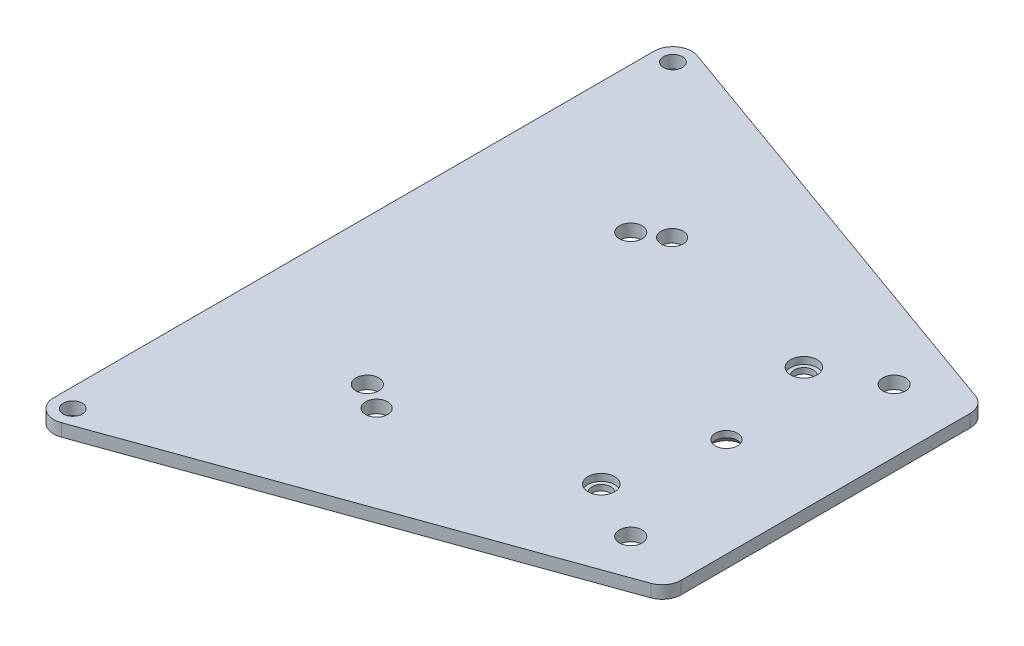
from build123d import *

# Parameters (mm, degrees)
CROQUIS1_R              = 1.8
CROQUIS1_R_2            = 1.5
CROQUIS1_R_3            = 1.75
SALIENTE_EXTRUIR1_DEPTH = 2
CROQUIS2_R              = 2.6
CORTAR_EXTRUIR1_DEPTH   = 1
CORTAR_EXTRUIR1_DRAFT   = -40
CROQUIS3_R              = 2.1
CORTAR_EXTRUIR2_DEPTH   = 1.1


with BuildPart() as part:
    # Croquis1 → Saliente-Extruir1 (new body)
    with BuildSketch(Plane(origin=(0, 0, 0), x_dir=(1, 0, 0), z_dir=(0, 1, 0))):
        with BuildLine():
            Line((1.012419451, 2.824005463), (69.732419451, -21.812442877))
            ThreePointArc((69.732419451, -21.812442877), (71.173289461, -22.909783687), (71.72, -24.63644834))
            Line((71.72, -24.63644834), (71.72, -70.41355166))
            ThreePointArc((71.72, -70.41355166), (71.173289461, -72.140216313), (69.732419451, -73.237557123))
            Line((69.732419451, -73.237557123), (1.012419451, -97.874005463))
            ThreePointArc((1.012419451, -97.874005463), (-1.726664653, -97.503289461), (-3, -95.05))
            Line((-3, -95.05), (-3, 0))
            ThreePointArc((-3, 0), (-1.726664653, 2.453289461), (1.012419451, 2.824005463))
        make_face()
        with Locations(Location((20, -26.675, 0), (0, 0, 270))):
            Circle(CROQUIS1_R, mode=Mode.SUBTRACT)
        with Locations(Location((20, -68.395, 0), (0, 0, 270))):
            Circle(CROQUIS1_R, mode=Mode.SUBTRACT)
        with Locations(Location((61.72, -26.675, 0), (0, 0, 270))):
            Circle(CROQUIS1_R, mode=Mode.SUBTRACT)
        with Locations(Location((61.72, -68.395, 0), (0, 0, 270))):
            Circle(CROQUIS1_R, mode=Mode.SUBTRACT)
        with Locations(Location((0, 0, 0), (0, 0, 270))):
            Circle(CROQUIS1_R_2, mode=Mode.SUBTRACT)
        with Locations(Location((0, -95.05, 0), (0, 0, 270))):
            Circle(CROQUIS1_R_2, mode=Mode.SUBTRACT)
        with Locations(Location((52.22, -31.49, 0), (0, 0, 270))):
            Circle(CROQUIS1_R_2, mode=Mode.SUBTRACT)
        with Locations(Location((52.22, -63.56, 0), (0, 0, 270))):
            Circle(CROQUIS1_R_2, mode=Mode.SUBTRACT)
        with Locations(Location((24, -70.925, 0), (0, 0, 270))):
            Circle(CROQUIS1_R_3, mode=Mode.SUBTRACT)
        with Locations(Location((24, -24.125, 0), (0, 0, 270))):
            Circle(CROQUIS1_R_3, mode=Mode.SUBTRACT)
        with Locations(Location((56, -47.525, 0), (0, 0, 270))):
            Circle(CROQUIS1_R_3, mode=Mode.SUBTRACT)
    extrude(amount=SALIENTE_EXTRUIR1_DEPTH)


with BuildPart() as cortar_extruir1_tool:
    # Croquis2 → Cortar-Extruir1 (with draft: the straight prism first)
    with BuildSketch(Plane.XZ):
        with Locations((56, 47.525)):
            Circle(CROQUIS2_R)
    extrude(amount=-CORTAR_EXTRUIR1_DEPTH)
    # Cortar-Extruir1: the draft: its side faces are tilted about the plane it starts from
    cortar_extruir1_sides = [cortar_extruir1_tool.faces().sort_by_distance(p)[0] for p in [
        (53.4, 0.5, 47.525),
    ]]
    draft(cortar_extruir1_sides, Plane.XZ, CORTAR_EXTRUIR1_DRAFT)


with BuildPart() as part_1:
    add(part.part)

    # Cortar-Extruir1: cut by cortar_extruir1_tool
    add(cortar_extruir1_tool.part, mode=Mode.SUBTRACT)

    # Croquis3 → Cortar-Extruir2 (cut)
    with BuildSketch(Plane(origin=(0, 2, 0), x_dir=(1, 0, 0), z_dir=(0, 1, 0))):
        with Locations(Location((52.22, -31.49, 0), (0, 0, 270))):
            Circle(CROQUIS3_R)
        with Locations(Location((52.22, -63.56, 0), (0, 0, 270))):
            Circle(CROQUIS3_R)
    extrude(amount=-CORTAR_EXTRUIR2_DEPTH, mode=Mode.SUBTRACT)


solid = part_1.part
